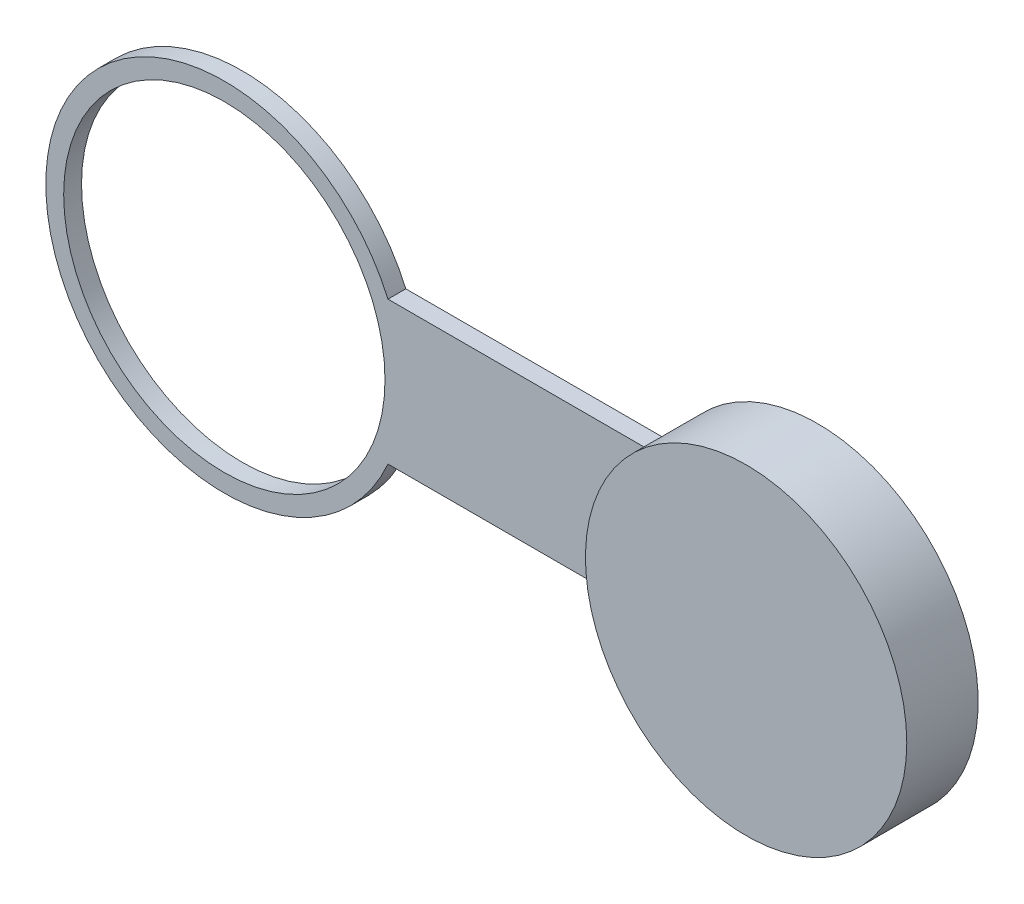
from build123d import *

# Parameters (mm, degrees)
SKETCH1_R           = 45
BOSS_EXTRUDE1_DEPTH = 20
SKETCH2_R           = 50
SKETCH2_R_2         = 45
BOSS_EXTRUDE2_DEPTH = 5


with BuildPart() as part:
    # Sketch1 → Boss-Extrude1 (new body)
    with BuildSketch(Plane.XY):
        Circle(SKETCH1_R)
    extrude(amount=BOSS_EXTRUDE1_DEPTH)

    # Sketch2 → Boss-Extrude2 (add)
    # profile 1 of 2: a face of its own
    with BuildSketch(Plane(origin=(0, 0, 0), x_dir=(-1, 0, 0), z_dir=(0, 0, -1))):
        with BuildLine():
            Line((115.311288741, 20), (40.311288741, 20))
            ThreePointArc((40.311288741, 20), (43.812144397, 10.271124735), (45, 0))
            ThreePointArc((45, 0), (43.812144397, -10.271124735), (40.311288741, -20))
            Line((40.311288741, -20), (115.311288741, -20))
            ThreePointArc((115.311288741, -20), (111.137045691, 0), (115.311288741, 20))
        make_face()
    # profile 2 of 2: a face of its own
    with BuildSketch(Plane(origin=(0, 0, 0), x_dir=(-1, 0, 0), z_dir=(0, 0, -1))):
        with Locations((161.137045691, 0)):
            Circle(SKETCH2_R)
        with Locations((161.137045691, 0)):
            Circle(SKETCH2_R_2, mode=Mode.SUBTRACT)
    extrude(amount=-BOSS_EXTRUDE2_DEPTH)


solid = part.part
